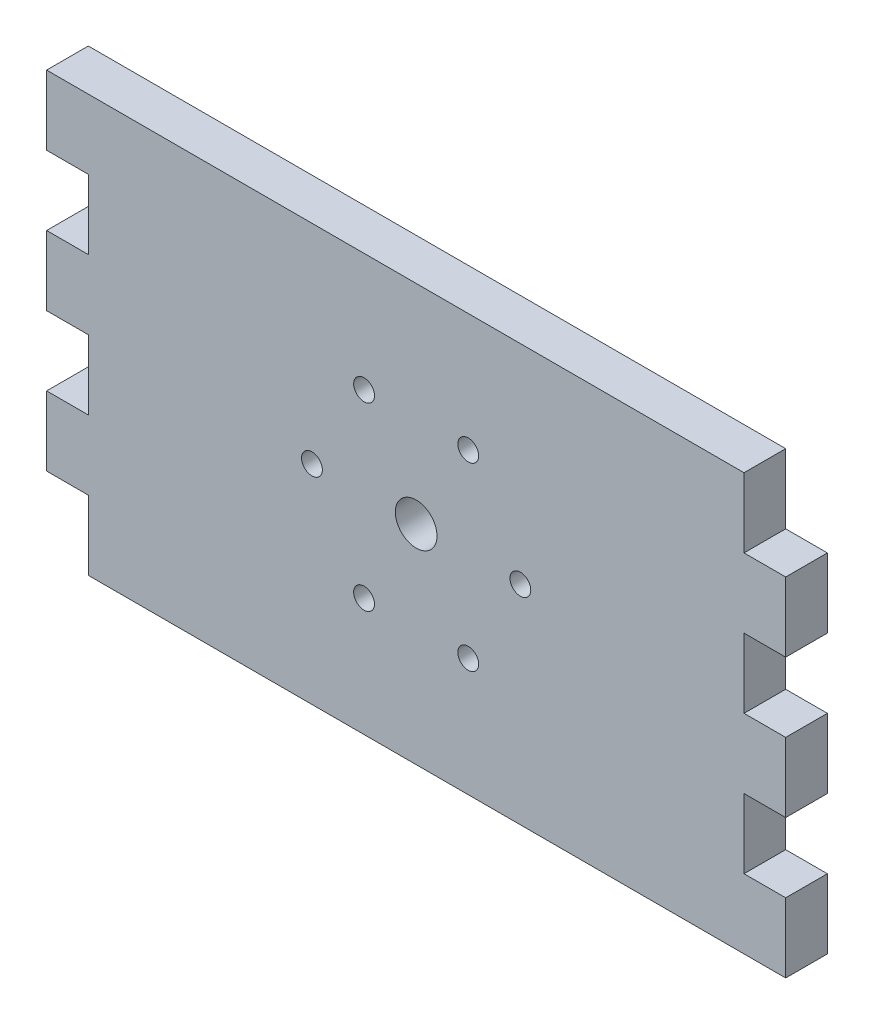
from build123d import *

# Parameters (mm, degrees)
SALIENTE_EXTRUIR1_DEPTH = 3
CORTAR_EXTRUIR1_REACH   = 32.685
CROQUIS2_R              = 1.5
CROQUIS2_R_2            = 0.75


with BuildPart() as part:
    # Croquis1 → Saliente-Extruir1 (new body)
    with BuildSketch(Plane.XY):
        Polygon((26.6, 5), (26.6, 10), (23.6, 10), (23.6, 15), (-26.6, 15), (-26.6, 10), (-23.6, 10), (-23.6, 5), (-26.6, 5), (-26.6, 0), (-23.6, 0), (-23.6, -5), (-26.6, -5), (-26.6, -10), (-23.6, -10), (-23.6, -15), (26.6, -15), (26.6, -10), (23.6, -10), (23.6, -5), (26.6, -5), (26.6, 0), (23.6, 0), (23.6, 5), align=None)
    extrude(amount=SALIENTE_EXTRUIR1_DEPTH)

    # Croquis2 → Cortar-Extruir1 (cut, up to next)
    with BuildSketch(Plane.XY.offset(3), mode=Mode.PRIVATE) as cortar_extruir1_sk1:
        Circle(CROQUIS2_R)
    cortar_extruir1_tool1 = extrude(cortar_extruir1_sk1.sketch, amount=-CORTAR_EXTRUIR1_REACH, mode=Mode.PRIVATE) & part.part
    # Croquis2 → Cortar-Extruir1 (cut, up to next)
    with BuildSketch(Plane.XY.offset(3), mode=Mode.PRIVATE) as cortar_extruir1_sk2:
        with Locations((7.5, 0)):
            Circle(CROQUIS2_R_2)
    cortar_extruir1_tool2 = extrude(cortar_extruir1_sk2.sketch, amount=-CORTAR_EXTRUIR1_REACH, mode=Mode.PRIVATE) & part.part
    # Croquis2 → Cortar-Extruir1 (cut, up to next)
    with BuildSketch(Plane.XY.offset(3), mode=Mode.PRIVATE) as cortar_extruir1_sk3:
        with Locations((3.75, -6.495190528)):
            Circle(CROQUIS2_R_2)
    cortar_extruir1_tool3 = extrude(cortar_extruir1_sk3.sketch, amount=-CORTAR_EXTRUIR1_REACH, mode=Mode.PRIVATE) & part.part
    # Croquis2 → Cortar-Extruir1 (cut, up to next)
    with BuildSketch(Plane.XY.offset(3), mode=Mode.PRIVATE) as cortar_extruir1_sk4:
        with Locations((-3.75, -6.495190528)):
            Circle(CROQUIS2_R_2)
    cortar_extruir1_tool4 = extrude(cortar_extruir1_sk4.sketch, amount=-CORTAR_EXTRUIR1_REACH, mode=Mode.PRIVATE) & part.part
    # Croquis2 → Cortar-Extruir1 (cut, up to next)
    with BuildSketch(Plane.XY.offset(3), mode=Mode.PRIVATE) as cortar_extruir1_sk5:
        with Locations((-7.5, 0)):
            Circle(CROQUIS2_R_2)
    cortar_extruir1_tool5 = extrude(cortar_extruir1_sk5.sketch, amount=-CORTAR_EXTRUIR1_REACH, mode=Mode.PRIVATE) & part.part
    # Croquis2 → Cortar-Extruir1 (cut, up to next)
    with BuildSketch(Plane.XY.offset(3), mode=Mode.PRIVATE) as cortar_extruir1_sk6:
        with Locations((-3.75, 6.495190528)):
            Circle(CROQUIS2_R_2)
    cortar_extruir1_tool6 = extrude(cortar_extruir1_sk6.sketch, amount=-CORTAR_EXTRUIR1_REACH, mode=Mode.PRIVATE) & part.part
    # Croquis2 → Cortar-Extruir1 (cut, up to next)
    with BuildSketch(Plane.XY.offset(3), mode=Mode.PRIVATE) as cortar_extruir1_sk7:
        with Locations((3.75, 6.495190528)):
            Circle(CROQUIS2_R_2)
    cortar_extruir1_tool7 = extrude(cortar_extruir1_sk7.sketch, amount=-CORTAR_EXTRUIR1_REACH, mode=Mode.PRIVATE) & part.part
    add(cortar_extruir1_tool1.solids().sort_by_distance((0, 0, 3))[0], mode=Mode.SUBTRACT)
    add(cortar_extruir1_tool2.solids().sort_by_distance((7.5, 0, 3))[0], mode=Mode.SUBTRACT)
    add(cortar_extruir1_tool3.solids().sort_by_distance((3.75, -6.495191, 3))[0], mode=Mode.SUBTRACT)
    add(cortar_extruir1_tool4.solids().sort_by_distance((-3.75, -6.495191, 3))[0], mode=Mode.SUBTRACT)
    add(cortar_extruir1_tool5.solids().sort_by_distance((-7.5, 0, 3))[0], mode=Mode.SUBTRACT)
    add(cortar_extruir1_tool6.solids().sort_by_distance((-3.75, 6.495191, 3))[0], mode=Mode.SUBTRACT)
    add(cortar_extruir1_tool7.solids().sort_by_distance((3.75, 6.495191, 3))[0], mode=Mode.SUBTRACT)


solid = part.part
